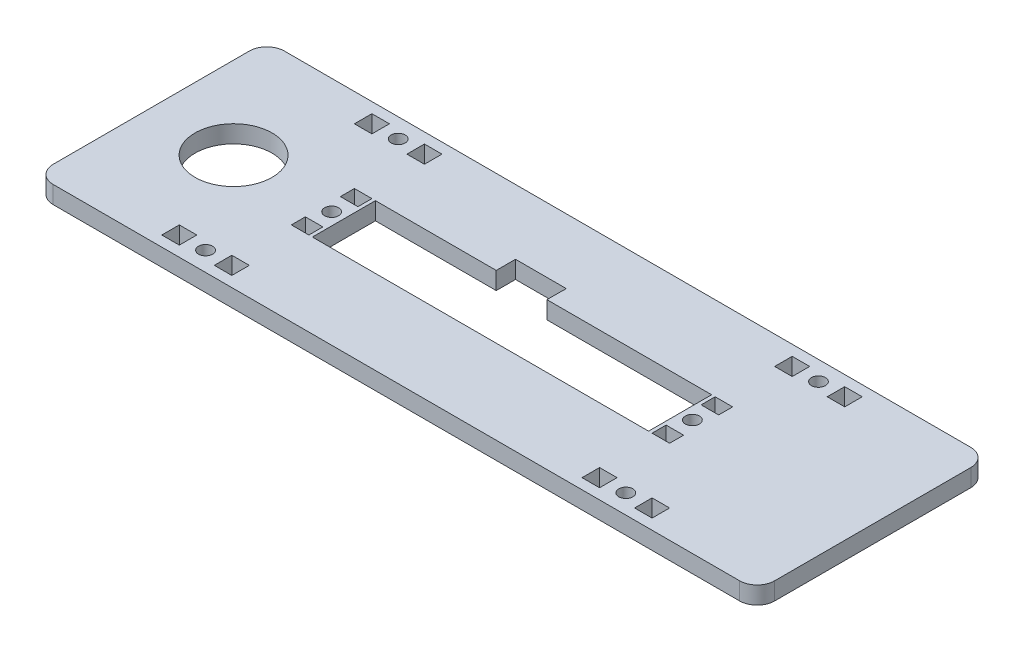
from build123d import *

# Parameters (mm, degrees)
SKETCH1_W           = 206
SKETCH1_H           = 66
SKETCH1_R           = 2
SKETCH1_R_2         = 11
SKETCH1_W_2         = 5
SKETCH1_H_2         = 5
SKETCH1_H_3         = 4
BOSS_EXTRUDE4_DEPTH = 5
FILLET9_R           = 5


with BuildPart() as part:
    # Sketch1 → Boss-Extrude4 (new body)
    with BuildSketch(Plane(origin=(0, 0, 0), x_dir=(1, 0, 0), z_dir=(0, 1, 0))):
        with Locations((5.102707087, 13.156325227)):
            Rectangle(SKETCH1_W, SKETCH1_H)
        with Locations(Location((-54.897292913, 40.656325227, 0), (0, 0, 270))):
            Circle(SKETCH1_R, mode=Mode.SUBTRACT)
        with Locations(Location((-54.897292913, -14.343674773, 0), (0, 0, 90))):
            Circle(SKETCH1_R, mode=Mode.SUBTRACT)
        with Locations(Location((65.102707087, -14.343674773, 0), (0, 0, 270))):
            Circle(SKETCH1_R, mode=Mode.SUBTRACT)
        with Locations(Location((65.102707087, 40.656325227, 0), (0, 0, 90))):
            Circle(SKETCH1_R, mode=Mode.SUBTRACT)
        with Locations(Location((-74.397292913, 13.156325227, 0), (0, 0, 270))):
            Circle(SKETCH1_R_2, mode=Mode.SUBTRACT)
        with Locations(Location((-46.397292913, 13.156325227, 0), (0, 0, 270))):
            Circle(SKETCH1_R, mode=Mode.SUBTRACT)
        with Locations(Location((56.602707087, 13.156325227, 0), (0, 0, 90))):
            Circle(SKETCH1_R, mode=Mode.SUBTRACT)
        with Locations((57.602707087, 40.656325227)):
            Rectangle(SKETCH1_W_2, SKETCH1_H_2, mode=Mode.SUBTRACT)
        with Locations((-62.397292913, 40.656325227)):
            Rectangle(SKETCH1_W_2, SKETCH1_H_2, mode=Mode.SUBTRACT)
        with Locations((-47.397292913, 40.656325227)):
            Rectangle(SKETCH1_W_2, SKETCH1_H_2, mode=Mode.SUBTRACT)
        with Locations((72.602707087, 40.656325227)):
            Rectangle(SKETCH1_W_2, SKETCH1_H_2, mode=Mode.SUBTRACT)
        with Locations((72.602707087, -14.343674773)):
            Rectangle(SKETCH1_W_2, SKETCH1_H_2, mode=Mode.SUBTRACT)
        with Locations((57.602707087, -14.343674773)):
            Rectangle(SKETCH1_W_2, SKETCH1_H_2, mode=Mode.SUBTRACT)
        with Locations((-47.397292913, -14.343674773)):
            Rectangle(SKETCH1_W_2, SKETCH1_H_2, mode=Mode.SUBTRACT)
        with Locations((-62.397292913, -14.343674773)):
            Rectangle(SKETCH1_W_2, SKETCH1_H_2, mode=Mode.SUBTRACT)
        with Locations((-46.397292913, 20.156325227)):
            Rectangle(SKETCH1_W_2, SKETCH1_H_3, mode=Mode.SUBTRACT)
        with Locations((-46.397292913, 6.156325227)):
            Rectangle(SKETCH1_W_2, SKETCH1_H_3, mode=Mode.SUBTRACT)
        with Locations((56.602707087, 6.156325227)):
            Rectangle(SKETCH1_W_2, SKETCH1_H_3, mode=Mode.SUBTRACT)
        with Locations((56.602707087, 20.156325227)):
            Rectangle(SKETCH1_W_2, SKETCH1_H_3, mode=Mode.SUBTRACT)
        Polygon((6.068183228, 4.156325227), (53.102707087, 4.156325227), (53.102707087, 22.156325227), (6.068183228, 22.156325227), (6.102707086, 27.656216871), (-8.397292913, 27.656325227), (-8.397292913, 22.156325227), (-42.897292913, 22.156325227), (-42.897292913, 4.156325227), (-8.397292913, 4.156325227), align=None, mode=Mode.SUBTRACT)
    extrude(amount=BOSS_EXTRUDE4_DEPTH)

    # Fillet9
    fillet9_edges = [part.edges().sort_by_distance(p)[0] for p in [
        (-97.897292913, 2.5, -46.156325227),
        (108.102707087, 2.5, -46.156325227),
        (108.102707087, 2.5, 19.843674773),
        (-97.897292913, 2.5, 19.843674773),
    ]]
    fillet(fillet9_edges, radius=FILLET9_R)


solid = part.part
